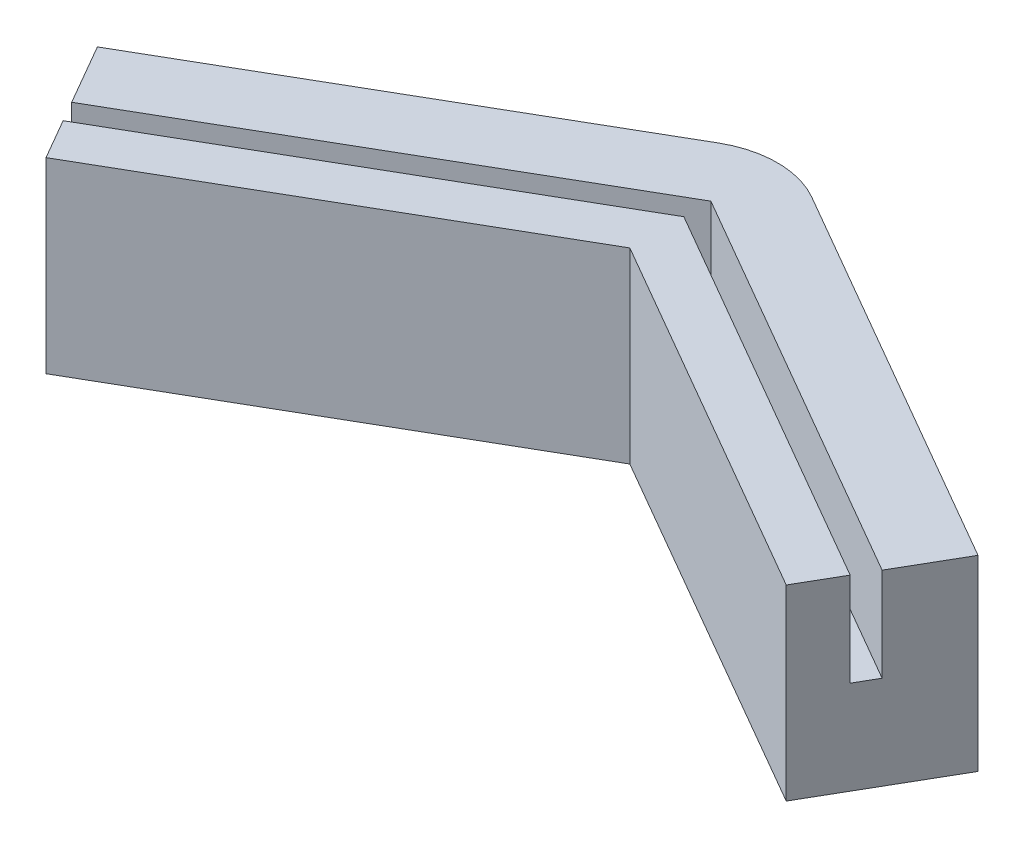
from build123d import *

# Parameters (mm, degrees)
BOSS_EXTRUDE1_DEPTH = 40
CUT_EXTRUDE1_DEPTH  = 20


with BuildPart() as part:
    # Sketch1 → Boss-Extrude1 (new body)
    with BuildSketch(Plane(origin=(0, 0, 0), x_dir=(1, 0, 0), z_dir=(0, 1, 0))):
        with BuildLine():
            Line((10, -5.773502692), (94.102760382, -54.330254038))
            Line((94.102760382, -54.330254038), (79.102760382, -80.311016151))
            Line((79.102760382, -80.311016151), (0, -34.641016151))
            Line((0, -34.641016151), (-79.102760382, -80.311016151))
            Line((-79.102760382, -80.311016151), (-94.102760382, -54.330254038))
            Line((-94.102760382, -54.330254038), (-10, -5.773502692))
            ThreePointArc((-10, -5.773502692), (0, -3.094010768), (10, -5.773502692))
        make_face()
    extrude(amount=BOSS_EXTRUDE1_DEPTH)

    # Sketch2 → Cut-Extrude1 (cut)
    with BuildSketch(Plane(origin=(0, 40, 0), x_dir=(1, 0, 0), z_dir=(0, 1, 0))):
        Polygon((-86.602760382, -67.320635095), (0, -17.320508076), (86.602760382, -67.320635095), (84.102760382, -71.650762114), (0, -23.094010768), (-84.102760382, -71.650762114), align=None)
    extrude(amount=-CUT_EXTRUDE1_DEPTH, mode=Mode.SUBTRACT)


solid = part.part
